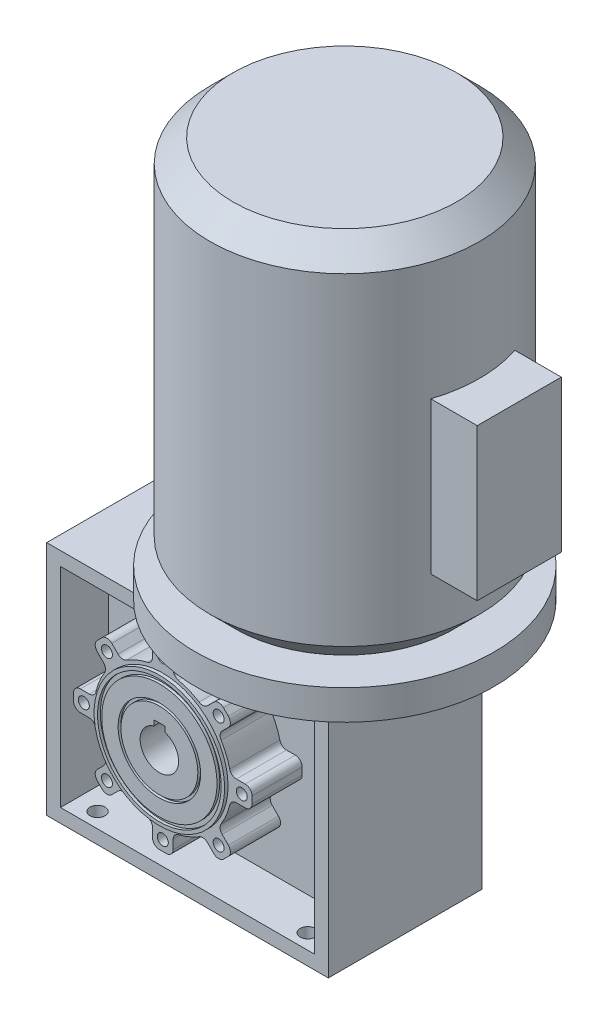
from build123d import *

# Parameters (mm, degrees)
SKETCH1_W                   = 205
SKETCH1_H                   = 172
SKETCH1_R                   = 14
BOSS_EXTRUDE1_DEPTH         = 112
SKETCH4_W                   = 185
SKETCH4_H                   = 152
SKETCH4_R                   = 50
CUT_EXTRUDE1_DEPTH          = 35
CUT_EXTRUDE2_START          = -46
SKETCH5_W                   = 185
SKETCH5_H                   = 152
SKETCH5_R                   = 50
CUT_EXTRUDE2_DEPTH          = 46
BOSS_EXTRUDE2_REACH         = 593.953
SKETCH7_R                   = 4
CUT_EXTRUDE3_DEPTH          = 592.953176756
FILLET1_R                   = 5
CIRPATTERN1_COUNT           = 8
FILLET1_OF_CIRPATTERN1_R    = 5
BOSS_EXTRUDE_START          = 1.5
SKETCH8_R                   = 4
SKETCH8_R_2                 = 14
BOSS_EXTRUDE_ONE_SIDE_DEPTH = 1.5
BOSS_EXTRUDE5_START         = 2.5
SKETCH9_R                   = 47.5
SKETCH9_R_2                 = 14
BOSS_EXTRUDE5_DEPTH         = 2.5
SKETCH10_R                  = 45
SKETCH10_R_2                = 42
CUT_EXTRUDE4_DEPTH          = 2
SKETCH11_R                  = 30
SKETCH11_R_2                = 28
CUT_EXTRUDE5_DEPTH          = 2
SKETCH12_W                  = 61.185896752
SKETCH12_H                  = 110.397308301
BOSS_EXTRUDE6_DEPTH         = 83
SKETCH14_R                  = 5.5
CUT_EXTRUDE6_DEPTH          = 15
CUT_EXTRUDE7_DEPTH          = 603.663425252


with BuildPart() as part:
    # Sketch1 → Boss-Extrude1 (new body)
    with BuildSketch(Plane.XY):
        with Locations((137.5, 86)):
            Rectangle(SKETCH1_W, SKETCH1_H)
        with Locations((121, 86)):
            Circle(SKETCH1_R, mode=Mode.SUBTRACT)
    extrude(amount=-BOSS_EXTRUDE1_DEPTH)

    # Sketch2 → Motor (revolve)
    with BuildSketch(Plane.XY.offset(-56), mode=Mode.PRIVATE) as motor_sk:
        Polygon((275.70575939, 209.906858954), (294.11120734, 228.312306904), (294.11120734, 463.339532419), (277.450739759, 480), (196, 480), (196, 172), (237.668295749, 172), (237.668295749, 188.093141046), (304.743012113, 188.093141046), (304.743012113, 199), (304.743012113, 209.906858954), align=None)
    revolve(motor_sk.sketch.rotate(Axis((196, 62.148817078, -56), (0, 1, 0)), 90), axis=Axis((196, 62.148817078, -56), (0, 1, 0)))

    # Sketch4 → Cut-Extrude1 (cut)
    with BuildSketch(Plane.XY):
        with Locations((137.5, 86)):
            Rectangle(SKETCH4_W, SKETCH4_H)
        with Locations((121, 86)):
            Circle(SKETCH4_R, mode=Mode.SUBTRACT)
    extrude(amount=-CUT_EXTRUDE1_DEPTH, mode=Mode.SUBTRACT)

    # Sketch5 → Cut-Extrude2 (cut)
    with BuildSketch(Plane(origin=(0, 0, -112), x_dir=(-1, 0, 0), z_dir=(0, 0, -1)).offset(CUT_EXTRUDE2_START)):
        with Locations((-137.5, 86)):
            Rectangle(SKETCH5_W, SKETCH5_H)
        with Locations(Location((-121, 86, 0), (0, 0, 180))):
            Circle(SKETCH5_R, mode=Mode.SUBTRACT)
    extrude(amount=CUT_EXTRUDE2_DEPTH, mode=Mode.SUBTRACT)

    # Boss-Extrude2: up to this face of the body (flat: up to its plane)
    boss_extrude2_end = Plane(part.part.faces().sort_by_distance((72.414213562, 86, -112))[0])
    # Sketch6 → Boss-Extrude2 (add, up to the picked face)
    with BuildSketch(Plane.XY, mode=Mode.PRIVATE) as boss_extrude2_sk1:
        with BuildLine():
            Line((113.5, 135.434299833), (113.5, 151))
            Line((113.5, 151), (128.5, 151))
            Line((128.5, 151), (128.5, 135.434299833))
            ThreePointArc((128.5, 135.434299833), (121, 136), (113.5, 135.434299833))
        make_face()
    boss_extrude2_tool1 = split(extrude(boss_extrude2_sk1.sketch, amount=-BOSS_EXTRUDE2_REACH, mode=Mode.PRIVATE), bisect_by=boss_extrude2_end, keep=Keep.BOTH, mode=Mode.PRIVATE)
    boss_extrude2 = boss_extrude2_tool1.solids().sort_by(Axis((121, 143.404996, 0), (0, 0, -1)))[0]
    add(boss_extrude2)

    # Sketch7 → Cut-Extrude3 (cut, through all)
    with BuildSketch(Plane.XY):
        with Locations((121, 143.5)):
            Circle(SKETCH7_R)
    cut_extrude3 = extrude(amount=-CUT_EXTRUDE3_DEPTH, mode=Mode.SUBTRACT)

    # Fillet1
    fillet1_edges = [part.edges().sort_by_distance(p)[0] for p in [
        (128.5, 135.434299833, -17.5),
        (113.5, 151, -17.5),
        (113.5, 135.434299833, -17.5),
        (128.5, 151, -17.5),
        (128.5, 135.434299833, -89),
        (113.5, 135.434299833, -89),
        (113.5, 151, -89),
        (128.5, 151, -89),
    ]]
    fillet(fillet1_edges, radius=FILLET1_R)

    # CirPattern1: Boss-Extrude2, Cut-Extrude3 ×8 about axis
    cirpattern1_axis = Axis((121, 86, 0), (0, 0, 1))
    add([boss_extrude2.rotate(cirpattern1_axis, i * 360 / CIRPATTERN1_COUNT) for i in range(1, CIRPATTERN1_COUNT)])
    add([cut_extrude3.rotate(cirpattern1_axis, i * 360 / CIRPATTERN1_COUNT) for i in range(1, CIRPATTERN1_COUNT)], mode=Mode.SUBTRACT)

    # Fillet1 of CirPattern1
    fillet1_of_cirpattern1_edges = [part.edges().sort_by_distance(p)[0] for p in [
        (91.347972224, 126.258629494, -17.5),
        (69.734758364, 126.658639918, -17.5),
        (80.741370506, 115.652027776, -17.5),
        (80.341360082, 137.265241636, -17.5),
        (91.347972224, 126.258629494, -89),
        (80.741370506, 115.652027776, -89),
        (69.734758364, 126.658639918, -89),
        (80.341360082, 137.265241636, -89),
        (71.565700167, 93.5, -17.5),
        (56, 78.5, -17.5),
        (71.565700167, 78.5, -17.5),
        (56, 93.5, -17.5),
        (71.565700167, 93.5, -89),
        (71.565700167, 78.5, -89),
        (56, 78.5, -89),
        (56, 93.5, -89),
        (80.741370506, 56.347972224, -17.5),
        (80.341360082, 34.734758364, -17.5),
        (91.347972224, 45.741370506, -17.5),
        (69.734758364, 45.341360082, -17.5),
        (80.741370506, 56.347972224, -89),
        (91.347972224, 45.741370506, -89),
        (80.341360082, 34.734758364, -89),
        (69.734758364, 45.341360082, -89),
        (113.5, 36.565700167, -17.5),
        (128.5, 21, -17.5),
        (128.5, 36.565700167, -17.5),
        (113.5, 21, -17.5),
        (113.5, 36.565700167, -89),
        (128.5, 36.565700167, -89),
        (128.5, 21, -89),
        (113.5, 21, -89),
        (150.652027776, 45.741370506, -17.5),
        (172.265241636, 45.341360082, -17.5),
        (161.258629494, 56.347972224, -17.5),
        (161.658639918, 34.734758364, -17.5),
        (150.652027776, 45.741370506, -89),
        (161.258629494, 56.347972224, -89),
        (172.265241636, 45.341360082, -89),
        (161.658639918, 34.734758364, -89),
        (170.434299833, 78.5, -17.5),
        (186, 93.5, -17.5),
        (170.434299833, 93.5, -17.5),
        (186, 78.5, -17.5),
        (170.434299833, 78.5, -89),
        (170.434299833, 93.5, -89),
        (186, 93.5, -89),
        (186, 78.5, -89),
        (161.258629494, 115.652027776, -17.5),
        (161.658639918, 137.265241636, -17.5),
        (150.652027776, 126.258629494, -17.5),
        (172.265241636, 126.658639918, -17.5),
        (161.258629494, 115.652027776, -89),
        (150.652027776, 126.258629494, -89),
        (161.658639918, 137.265241636, -89),
        (172.265241636, 126.658639918, -89),
    ]]
    fillet(fillet1_of_cirpattern1_edges, radius=FILLET1_OF_CIRPATTERN1_R)

    # Sketch8 → Boss-Extrude one side (add)
    with BuildSketch(Plane.XY.offset(BOSS_EXTRUDE_START)):
        with BuildLine():
            Line((88.43015734, 129.176444378), (83.876893988, 133.72970773))
            ThreePointArc((83.876893988, 133.72970773), (80.341360082, 135.194173824), (76.805826176, 133.72970773))
            Line((76.805826176, 133.72970773), (73.27029227, 130.194173824))
            ThreePointArc((73.27029227, 130.194173824), (71.805826176, 126.658639918), (73.27029227, 123.123106012))
            Line((73.27029227, 123.123106012), (77.823555622, 118.56984266))
            ThreePointArc((77.823555622, 118.56984266), (79.255202946, 115.606244619), (78.534565197, 112.39482614))
            ThreePointArc((78.534565197, 112.39482614), (74.806023374, 105.134171618), (72.308442533, 97.363636364))
            ThreePointArc((72.308442533, 97.363636364), (70.547194588, 94.583252741), (67.439286786, 93.5))
            Line((67.439286786, 93.5), (61, 93.5))
            ThreePointArc((61, 93.5), (57.464466094, 92.035533906), (56, 88.5))
            Line((56, 88.5), (56, 83.5))
            ThreePointArc((56, 83.5), (57.464466094, 79.964466094), (61, 78.5))
            Line((61, 78.5), (67.439286786, 78.5))
            ThreePointArc((67.439286786, 78.5), (70.547194588, 77.416747259), (72.308442533, 74.636363636))
            ThreePointArc((72.308442533, 74.636363636), (74.806023374, 66.865828382), (78.534565197, 59.60517386))
            ThreePointArc((78.534565197, 59.60517386), (79.255202946, 56.393755381), (77.823555622, 53.43015734))
            Line((77.823555622, 53.43015734), (73.27029227, 48.876893988))
            ThreePointArc((73.27029227, 48.876893988), (71.805826176, 45.341360082), (73.27029227, 41.805826176))
            Line((73.27029227, 41.805826176), (76.805826176, 38.27029227))
            ThreePointArc((76.805826176, 38.27029227), (80.341360082, 36.805826176), (83.876893988, 38.27029227))
            Line((83.876893988, 38.27029227), (88.43015734, 42.823555622))
            ThreePointArc((88.43015734, 42.823555622), (91.393755381, 44.255202946), (94.60517386, 43.534565197))
            ThreePointArc((94.60517386, 43.534565197), (101.865828382, 39.806023374), (109.636363636, 37.308442533))
            ThreePointArc((109.636363636, 37.308442533), (112.416747259, 35.547194588), (113.5, 32.439286786))
            Line((113.5, 32.439286786), (113.5, 26))
            ThreePointArc((113.5, 26), (114.964466094, 22.464466094), (118.5, 21))
            Line((118.5, 21), (123.5, 21))
            ThreePointArc((123.5, 21), (127.035533906, 22.464466094), (128.5, 26))
            Line((128.5, 26), (128.5, 32.439286786))
            ThreePointArc((128.5, 32.439286786), (129.583252741, 35.547194588), (132.363636364, 37.308442533))
            ThreePointArc((132.363636364, 37.308442533), (140.134171618, 39.806023374), (147.39482614, 43.534565197))
            ThreePointArc((147.39482614, 43.534565197), (150.606244619, 44.255202946), (153.56984266, 42.823555622))
            Line((153.56984266, 42.823555622), (158.123106012, 38.27029227))
            ThreePointArc((158.123106012, 38.27029227), (161.658639918, 36.805826176), (165.194173824, 38.27029227))
            Line((165.194173824, 38.27029227), (168.72970773, 41.805826176))
            ThreePointArc((168.72970773, 41.805826176), (170.194173824, 45.341360082), (168.72970773, 48.876893988))
            Line((168.72970773, 48.876893988), (164.176444378, 53.43015734))
            ThreePointArc((164.176444378, 53.43015734), (162.744797054, 56.393755381), (163.465434803, 59.60517386))
            ThreePointArc((163.465434803, 59.60517386), (167.193976626, 66.865828382), (169.691557467, 74.636363636))
            ThreePointArc((169.691557467, 74.636363636), (171.452805412, 77.416747259), (174.560713214, 78.5))
            Line((174.560713214, 78.5), (181, 78.5))
            ThreePointArc((181, 78.5), (184.535533906, 79.964466094), (186, 83.5))
            Line((186, 83.5), (186, 88.5))
            ThreePointArc((186, 88.5), (184.535533906, 92.035533906), (181, 93.5))
            Line((181, 93.5), (174.560713214, 93.5))
            ThreePointArc((174.560713214, 93.5), (171.452805412, 94.583252741), (169.691557467, 97.363636364))
            ThreePointArc((169.691557467, 97.363636364), (167.193976626, 105.134171618), (163.465434803, 112.39482614))
            ThreePointArc((163.465434803, 112.39482614), (162.744797054, 115.606244619), (164.176444378, 118.56984266))
            Line((164.176444378, 118.56984266), (168.72970773, 123.123106012))
            ThreePointArc((168.72970773, 123.123106012), (170.194173824, 126.658639918), (168.72970773, 130.194173824))
            Line((168.72970773, 130.194173824), (165.194173824, 133.72970773))
            ThreePointArc((165.194173824, 133.72970773), (161.658639918, 135.194173824), (158.123106012, 133.72970773))
            Line((158.123106012, 133.72970773), (153.56984266, 129.176444378))
            ThreePointArc((153.56984266, 129.176444378), (150.606244619, 127.744797054), (147.39482614, 128.465434803))
            ThreePointArc((147.39482614, 128.465434803), (140.134171618, 132.193976626), (132.363636364, 134.691557467))
            ThreePointArc((132.363636364, 134.691557467), (129.583252741, 136.452805412), (128.5, 139.560713214))
            Line((128.5, 139.560713214), (128.5, 146))
            ThreePointArc((128.5, 146), (127.035533906, 149.535533906), (123.5, 151))
            Line((123.5, 151), (118.5, 151))
            ThreePointArc((118.5, 151), (114.964466094, 149.535533906), (113.5, 146))
            Line((113.5, 146), (113.5, 139.560713214))
            ThreePointArc((113.5, 139.560713214), (112.416747259, 136.452805412), (109.636363636, 134.691557467))
            ThreePointArc((109.636363636, 134.691557467), (101.865828382, 132.193976626), (94.60517386, 128.465434803))
            ThreePointArc((94.60517386, 128.465434803), (91.393755381, 127.744797054), (88.43015734, 129.176444378))
        make_face()
        with Locations((161.658639918, 45.341360082)):
            Circle(SKETCH8_R, mode=Mode.SUBTRACT)
        with Locations((121, 28.5)):
            Circle(SKETCH8_R, mode=Mode.SUBTRACT)
        with Locations((80.341360082, 45.341360082)):
            Circle(SKETCH8_R, mode=Mode.SUBTRACT)
        with Locations((63.5, 86)):
            Circle(SKETCH8_R, mode=Mode.SUBTRACT)
        with Locations((178.5, 86)):
            Circle(SKETCH8_R, mode=Mode.SUBTRACT)
        with Locations((161.658639918, 126.658639918)):
            Circle(SKETCH8_R, mode=Mode.SUBTRACT)
        with Locations((121, 86)):
            Circle(SKETCH8_R_2, mode=Mode.SUBTRACT)
        with Locations((80.341360082, 126.658639918)):
            Circle(SKETCH8_R, mode=Mode.SUBTRACT)
        with Locations((121, 143.5)):
            Circle(SKETCH8_R, mode=Mode.SUBTRACT)
    boss_extrude_one_side = extrude(amount=-BOSS_EXTRUDE_ONE_SIDE_DEPTH)

    # Sketch9 → Boss-Extrude5 (add)
    with BuildSketch(Plane.XY.offset(1.5).offset(BOSS_EXTRUDE5_START)):
        with Locations((121, 86)):
            Circle(SKETCH9_R)
        with Locations((121, 86)):
            Circle(SKETCH9_R_2, mode=Mode.SUBTRACT)
    boss_extrude5 = extrude(amount=-BOSS_EXTRUDE5_DEPTH)

    # Sketch10 → Cut-Extrude4 (cut)
    with BuildSketch(Plane.XY.offset(4)):
        with Locations((121, 86)):
            Circle(SKETCH10_R)
        with Locations((121, 86)):
            Circle(SKETCH10_R_2, mode=Mode.SUBTRACT)
    cut_extrude4 = extrude(amount=-CUT_EXTRUDE4_DEPTH, mode=Mode.SUBTRACT)

    # Sketch11 → Cut-Extrude5 (cut)
    with BuildSketch(Plane.XY.offset(4)):
        with Locations((121, 86)):
            Circle(SKETCH11_R)
        with Locations((121, 86)):
            Circle(SKETCH11_R_2, mode=Mode.SUBTRACT)
    cut_extrude5 = extrude(amount=-CUT_EXTRUDE5_DEPTH, mode=Mode.SUBTRACT)

    # Sketch12 → Boss-Extrude6 (add)
    with BuildSketch(Plane(origin=(240, 0, 0), x_dir=(0, 0, -1), z_dir=(1, 0, 0))):
        with Locations((56, 321.836167597)):
            Rectangle(SKETCH12_W, SKETCH12_H)
    extrude(amount=BOSS_EXTRUDE6_DEPTH)

    # Mirror1: Boss-Extrude one side, Boss-Extrude5, Cut-Extrude4, Cut-Extrude5 across plane
    add(boss_extrude_one_side.mirror(Plane.XY.offset(-56)))
    add(boss_extrude5.mirror(Plane.XY.offset(-56)))
    add(cut_extrude4.mirror(Plane.XY.offset(-56)), mode=Mode.SUBTRACT)
    add(cut_extrude5.mirror(Plane.XY.offset(-56)), mode=Mode.SUBTRACT)

    # Sketch14 → Cut-Extrude6 (cut)
    with BuildSketch(Plane.XZ):
        with Locations((214, -11)):
            Circle(SKETCH14_R)
        with Locations((214, -101)):
            Circle(SKETCH14_R)
        with Locations((61, -101)):
            Circle(SKETCH14_R)
        with Locations((61, -11)):
            Circle(SKETCH14_R)
    extrude(amount=-CUT_EXTRUDE6_DEPTH, mode=Mode.SUBTRACT)

    # Sketch15 → Cut-Extrude7 (cut, through all)
    with BuildSketch(Plane.XY.offset(4)):
        with BuildLine():
            Line((125, 99.416407865), (125, 103.3))
            Line((125, 103.3), (117, 103.3))
            Line((117, 103.3), (117, 99.416407865))
            ThreePointArc((117, 99.416407865), (121, 100), (125, 99.416407865))
        make_face()
    extrude(amount=-CUT_EXTRUDE7_DEPTH, mode=Mode.SUBTRACT)


solid = part.part
